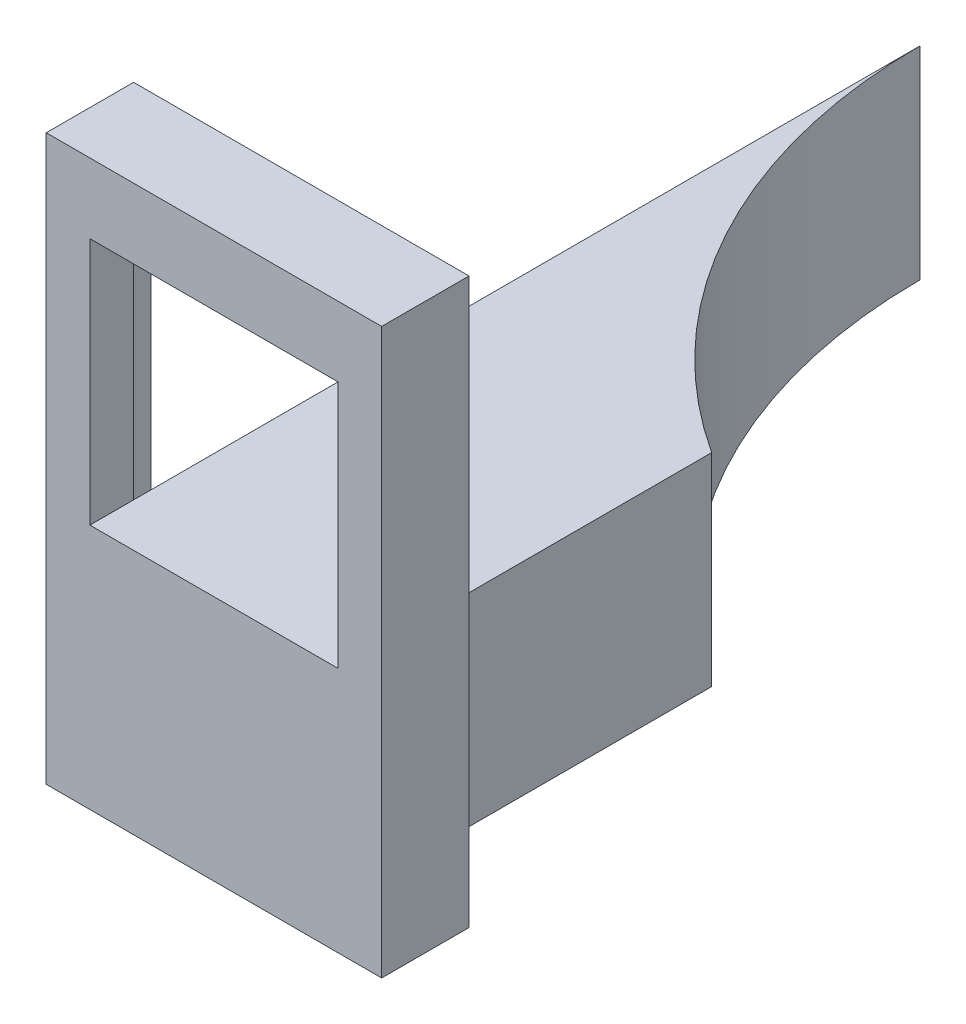
from build123d import *

# Parameters (mm, degrees)
SKETCH_8_W          = 34.4
SKETCH_8_H          = 60.6
SKETCH_8_W_2        = 28.4
SKETCH_8_H_2        = 51.6
EXTRUDE_4_DEPTH     = 5
SKETCH_9_W          = 28.4
SKETCH_9_H          = 23.2
EXTRUDE_5_DEPTH     = 95
SKETCH_10_R         = 62.2
CUT_EXTRUDE_3_DEPTH = 100
SKETCH_13_W         = 38.4
SKETCH_13_H         = 64.6
SKETCH_13_W_2       = 34.4
SKETCH_13_H_2       = 60.6
EXTRUDE_7_DEPTH     = 10


with BuildPart() as part:
    # 스케치8 → 보스-돌출4 (new body)
    with BuildSketch(Plane.XY):
        with Locations((17.2, 30.3)):
            Rectangle(SKETCH_8_W, SKETCH_8_H)
        with Locations((17.2, 28.8)):
            Rectangle(SKETCH_8_W_2, SKETCH_8_H_2, mode=Mode.SUBTRACT)
    extrude(amount=-EXTRUDE_4_DEPTH)

    # 스케치9 → 보스-돌출5 (add)
    with BuildSketch(Plane.XY):
        with Locations((17.2, 14.6)):
            Rectangle(SKETCH_9_W, SKETCH_9_H)
    extrude(amount=-EXTRUDE_5_DEPTH)

    # 스케치10 → 컷-돌출3 (cut)
    with BuildSketch(Plane(origin=(0, 26.2, 0), x_dir=(1, 0, 0), z_dir=(0, 1, 0))):
        with Locations((65.2, 95)):
            Circle(SKETCH_10_R)
    extrude(amount=-CUT_EXTRUDE_3_DEPTH, mode=Mode.SUBTRACT)

    # 스케치13 → 보스-돌출7 (add)
    with BuildSketch(Plane.XY):
        with Locations((17.2, 30.3)):
            Rectangle(SKETCH_13_W, SKETCH_13_H)
        with Locations((17.2, 30.3)):
            Rectangle(SKETCH_13_W_2, SKETCH_13_H_2, mode=Mode.SUBTRACT)
    extrude(amount=-EXTRUDE_7_DEPTH)


solid = part.part
